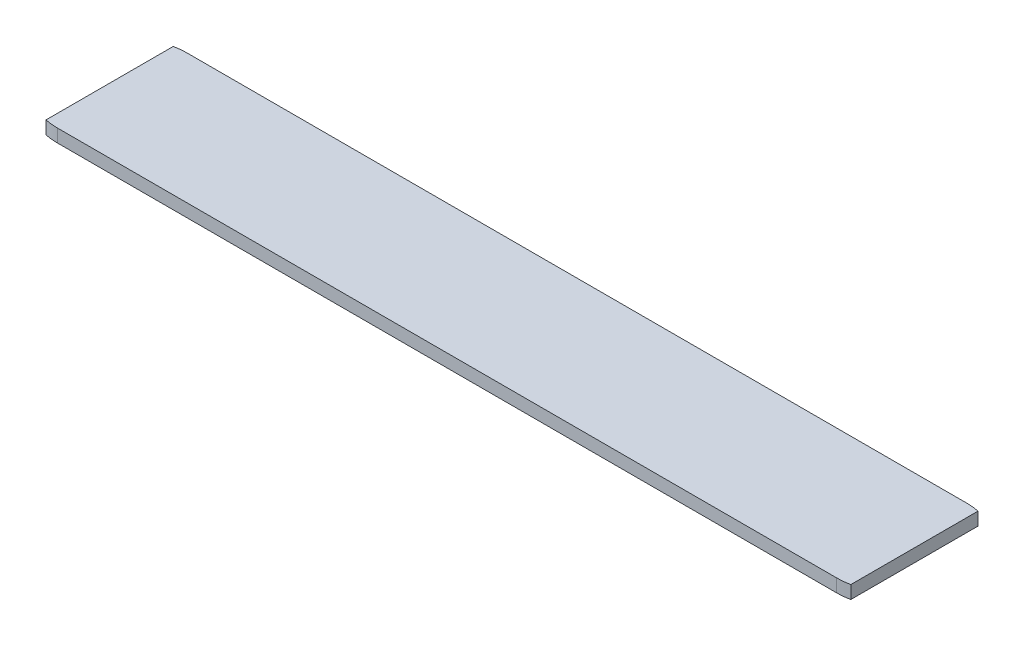
from build123d import *

# Parameters (mm, degrees)
BOSS_EXTRUDE1_DEPTH = 1.5875
SKETCH2_W           = 131.81654989
SKETCH2_H           = 36.580669347
SKETCH2_W_2         = 98.425
SKETCH2_H_2         = 15.875
CUT_EXTRUDE1_DEPTH  = 2.54


with BuildPart() as part:
    # Sketch1 → Boss-Extrude1 (new body)
    with BuildSketch(Plane(origin=(0, 0, 0), x_dir=(1, 0, 0), z_dir=(0, 1, 0))):
        with BuildLine():
            Line((-47.625, 7.9375), (47.625, 7.9375))
            ThreePointArc((47.625, 7.9375), (55.5625, 0), (47.625, -7.9375))
            Line((47.625, -7.9375), (-47.625, -7.9375))
            ThreePointArc((-47.625, -7.9375), (-55.5625, 0), (-47.625, 7.9375))
        make_face()
    extrude(amount=BOSS_EXTRUDE1_DEPTH)

    # Sketch2 → Cut-Extrude1 (cut)
    with BuildSketch(Plane(origin=(0, 1.5875, 0), x_dir=(1, 0, 0), z_dir=(0, 1, 0))):
        with Locations((1.471605837, -0.35764579)):
            Rectangle(SKETCH2_W, SKETCH2_H)
        Rectangle(SKETCH2_W_2, SKETCH2_H_2, mode=Mode.SUBTRACT)
    extrude(amount=-CUT_EXTRUDE1_DEPTH, mode=Mode.SUBTRACT)


solid = part.part
